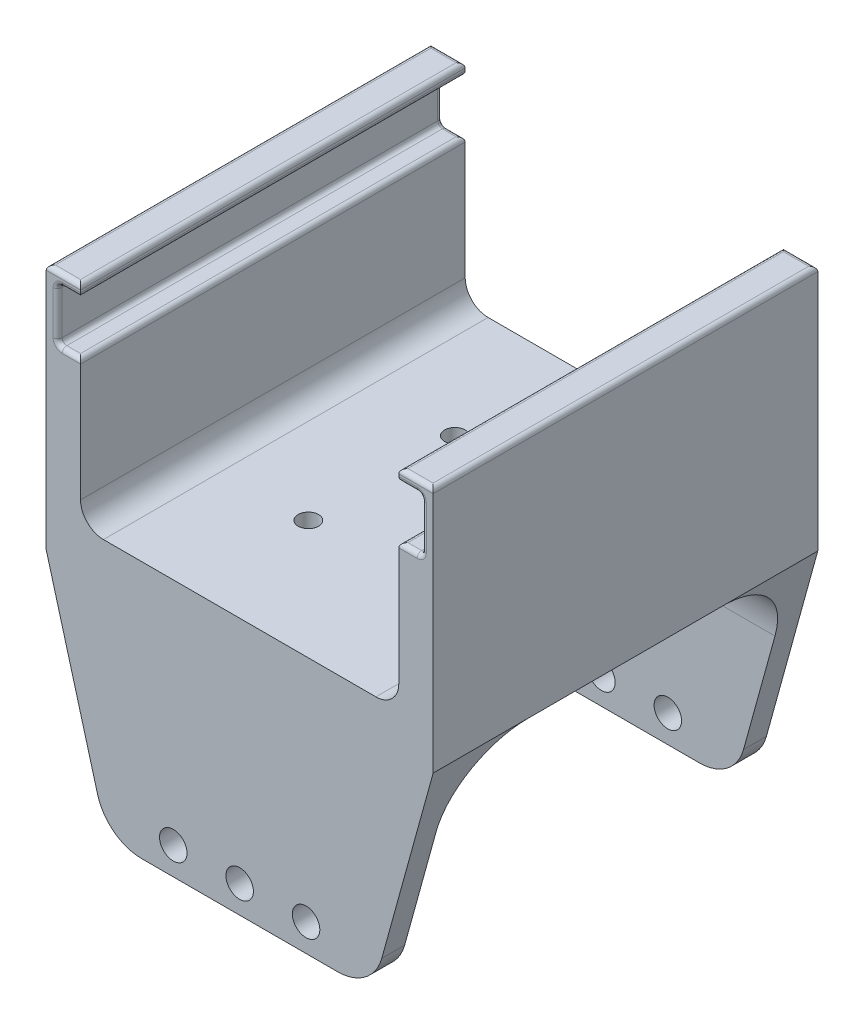
from build123d import *

# Parameters (mm, degrees)
SKETCH4_W               = 84.5
SKETCH4_H               = 84
BOSS_EXTRUDE1_DEPTH     = 8.175
SKETCH5_W               = 84.5
SKETCH5_H               = 5
BOSS_EXTRUDE2_DEPTH     = 48
SKETCH6_R               = 2.225
CUT_EXTRUDE1_DEPTH      = 48
SKETCH7_W               = 7.5
SKETCH7_H               = 84
BOSS_EXTRUDE3_DEPTH     = 31.675
SKETCH8_W               = 2.5
SKETCH8_H               = 84
BOSS_EXTRUDE4_DEPTH     = 11.5
CUT_EXTRUDE2_DEPTH      = 93
CUT_EXTRUDE2_DEPTH_BACK = 5
SKETCH9_R               = 3
SKETCH10_W              = 7.5
SKETCH10_H              = 84
BOSS_EXTRUDE5_DEPTH     = 2.5
FILLET1_R               = 1
CUT_EXTRUDE3_DEPTH      = 88
CUT_EXTRUDE3_DEPTH_BACK = 24.5
FILLET2_R               = 10
FILLET3_R               = 5
FILLET4_R               = 15.75


with BuildPart() as part:
    # Sketch4 → Boss-Extrude1 (new body)
    with BuildSketch(Plane(origin=(0, 25, 0), x_dir=(1, 0, 0), z_dir=(0, 1, 0))):
        with Locations((10, 37)):
            Rectangle(SKETCH4_W, SKETCH4_H)
    extrude(amount=BOSS_EXTRUDE1_DEPTH)

    # Sketch5 → Boss-Extrude2 (add)
    with BuildSketch(Plane.XZ.offset(-25)):
        with Locations((10, 2.5)):
            Rectangle(SKETCH5_W, SKETCH5_H)
        with Locations((10, -76.5)):
            Rectangle(SKETCH5_W, SKETCH5_H)
    extrude(amount=BOSS_EXTRUDE2_DEPTH)

    # Sketch6 → Cut-Extrude1 (cut)
    with BuildSketch(Plane.XZ.offset(-25)):
        with Locations(Location((-1, -21, 0), (0, 0, 270))):
            Circle(SKETCH6_R)
        with Locations(Location((-1, -53, 0), (0, 0, 270))):
            Circle(SKETCH6_R)
    extrude(amount=-CUT_EXTRUDE1_DEPTH, mode=Mode.SUBTRACT)

    # Sketch7 → Boss-Extrude3 (add)
    with BuildSketch(Plane(origin=(0, 33.175, 0), x_dir=(1, 0, 0), z_dir=(0, 1, 0))):
        with Locations((-28.5, 37)):
            Rectangle(SKETCH7_W, SKETCH7_H)
        with Locations((48.5, 37)):
            Rectangle(SKETCH7_W, SKETCH7_H)
    extrude(amount=BOSS_EXTRUDE3_DEPTH)

    # Sketch8 → Boss-Extrude4 (add)
    with BuildSketch(Plane(origin=(0, 64.85, 0), x_dir=(1, 0, 0), z_dir=(0, 1, 0))):
        with Locations((-31, 37)):
            Rectangle(SKETCH8_W, SKETCH8_H)
        with Locations((51, 37)):
            Rectangle(SKETCH8_W, SKETCH8_H)
    extrude(amount=BOSS_EXTRUDE4_DEPTH)

    # Sketch9 → Cut-Extrude2 (cut, two sides: drawn at the far end of the back side and taken through both)
    with BuildSketch(Plane(origin=(0, 0, 0), x_dir=(-1, 0, 0), z_dir=(0, 0, -1)).offset(-CUT_EXTRUDE2_DEPTH_BACK)):
        with Locations(Location((-10, -17, 0), (0, 0, 270))):
            Circle(SKETCH9_R)
        with Locations(Location((-24.5, -17, 0), (0, 0, 270))):
            Circle(SKETCH9_R)
        with Locations(Location((4.5, -17, 0), (0, 0, 270))):
            Circle(SKETCH9_R)
    extrude(amount=CUT_EXTRUDE2_DEPTH + CUT_EXTRUDE2_DEPTH_BACK, mode=Mode.SUBTRACT)

    # Sketch10 → Boss-Extrude5 (add)
    with BuildSketch(Plane(origin=(0, 76.35, 0), x_dir=(1, 0, 0), z_dir=(0, 1, 0))):
        with Locations((48.5, 37)):
            Rectangle(SKETCH10_W, SKETCH10_H)
        with Locations((-28.5, 37)):
            Rectangle(SKETCH10_W, SKETCH10_H)
    extrude(amount=BOSS_EXTRUDE5_DEPTH)

    # Fillet1
    fillet1_edges = [part.edges().sort_by_distance(p)[0] for p in [
        (47.25, 76.35, -79),
        (44.75, 76.35, -37),
        (47.25, 76.35, 5),
        (52.25, 78.85, -37),
        (48.5, 78.85, -79),
        (44.75, 78.85, -37),
        (48.5, 78.85, 5),
        (-27.25, 76.35, 5),
        (-24.75, 76.35, -37),
        (-27.25, 76.35, -79),
        (-32.25, 78.85, -37),
        (-28.5, 78.85, 5),
        (-24.75, 78.85, -37),
        (-28.5, 78.85, -79),
        (-24.75, 64.85, -37),
        (-27.25, 64.85, -79),
        (44.75, 64.85, -37),
        (47.25, 64.85, 5),
        (-27.25, 64.85, 5),
        (47.25, 64.85, -79),
        (-29.75, 64.85, -37),
        (-29.75, 70.6, 5),
        (-29.75, 70.6, -79),
        (-29.75, 76.35, -37),
        (49.75, 64.85, -37),
        (49.75, 70.6, -79),
        (49.75, 70.6, 5),
        (49.75, 76.35, -37),
    ]]
    fillet(fillet1_edges, radius=FILLET1_R)

    # Sketch11 → Cut-Extrude3 (cut, two sides: drawn at the far end of the back side and taken through both)
    with BuildSketch(Plane(origin=(0, 0, 0), x_dir=(-1, 0, 0), z_dir=(0, 0, -1)).offset(-CUT_EXTRUDE3_DEPTH_BACK)):
        Polygon((19, -23), (32.25, -23), (32.25, 25), align=None)
        Polygon((-39, -23), (-52.25, -23), (-52.25, 25), align=None)
    extrude(amount=CUT_EXTRUDE3_DEPTH + CUT_EXTRUDE3_DEPTH_BACK, mode=Mode.SUBTRACT)

    # Fillet2
    fillet2_edges = [part.edges().sort_by_distance(p)[0] for p in [
        (39, -23, 2.5),
        (-19, -23, 2.5),
        (-19, -23, -76.5),
        (39, -23, -76.5),
    ]]
    fillet(fillet2_edges, radius=FILLET2_R)

    # Fillet3
    fillet3_edges = [part.edges().sort_by_distance(p)[0] for p in [
        (-24.75, 33.175, -37),
        (44.75, 33.175, -37),
    ]]
    fillet(fillet3_edges, radius=FILLET3_R)

    # Fillet4
    fillet4_edges = [part.edges().sort_by_distance(p)[0] for p in [
        (10, 25, 0),
        (10, 25, -74),
    ]]
    fillet(fillet4_edges, radius=FILLET4_R)


solid = part.part
